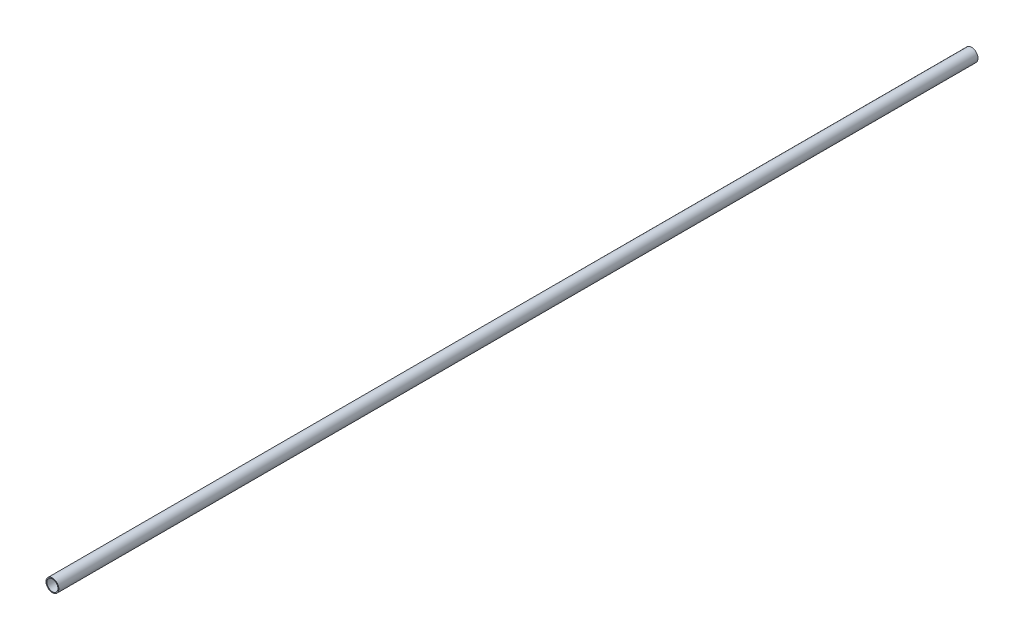
from build123d import *

# Parameters (mm, degrees)
SKETCH_1_R      = 7
SKETCH_1_R_2    = 6
EXTRUDE_1_DEPTH = 500


with BuildPart() as part:
    # Эскиз1 → Бобышка-Вытянуть1 (new, symmetric)
    with BuildSketch(Plane.XY):
        Circle(SKETCH_1_R)
        Circle(SKETCH_1_R_2, mode=Mode.SUBTRACT)
    extrude(amount=EXTRUDE_1_DEPTH, both=True)


solid = part.part
